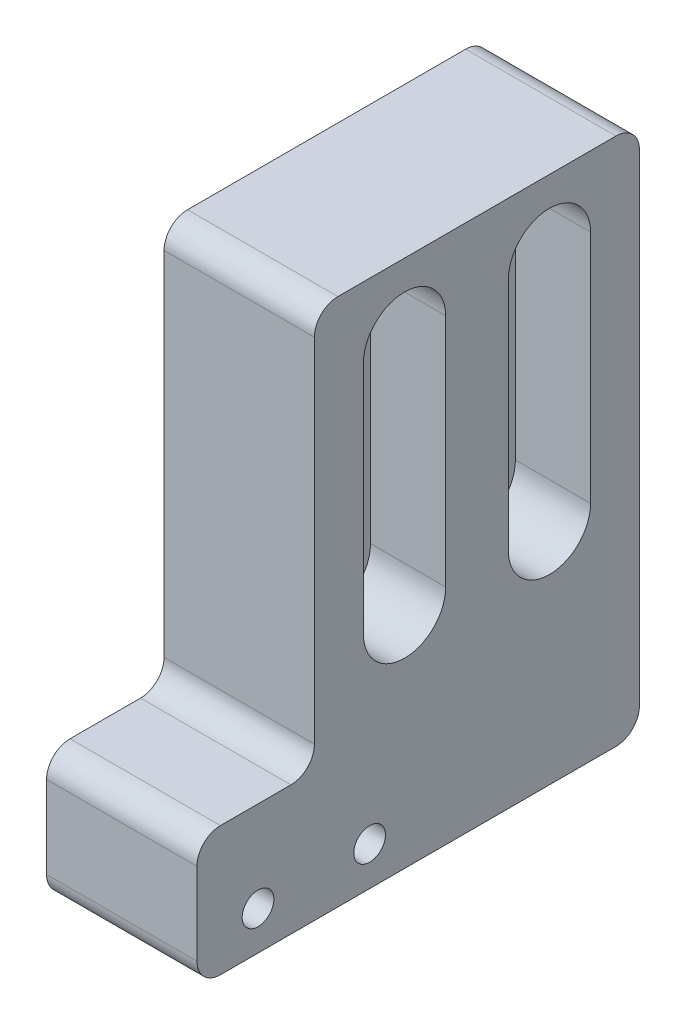
from build123d import *

# Parameters (mm, degrees)
SKETCH1_W                  = 37.6666666
SKETCH1_H                  = 45
BOSS_EXTRUDE1_DEPTH        = 12.8
SKETCH2_W                  = 10
SKETCH2_H                  = 34
CUT_EXTRUDE1_DEPTH         = 61.063447893
CUT_EXTRUDE2_DEPTH         = 6.4
CUT_EXTRUDE3_DEPTH         = 61.063447893
CUT_EXTRUDE4_DEPTH         = 6.4
CUT_EXTRUDE5_DEPTH         = 61.063447893
F_2_7_2_7_DIAMETER_HOLE1_D = 2.7
FILLET1_R                  = 2


with BuildPart() as part:
    # Sketch1 → Boss-Extrude1 (new body)
    with BuildSketch(Plane(origin=(0, 0, 0), x_dir=(0, 0, -1), z_dir=(1, 0, 0))):
        with Locations((-18.8333333, 22.5)):
            Rectangle(SKETCH1_W, SKETCH1_H)
    extrude(amount=-BOSS_EXTRUDE1_DEPTH)

    # Sketch2 → Cut-Extrude1 (cut, through all)
    with BuildSketch(Plane.ZY.offset(12.8)):
        with Locations((32.6666666, 28)):
            Rectangle(SKETCH2_W, SKETCH2_H)
    extrude(amount=-CUT_EXTRUDE1_DEPTH, mode=Mode.SUBTRACT)

    # Sketch3 → Cut-Extrude2 (cut)
    with BuildSketch(Plane(origin=(0, 0, 0), x_dir=(0, 0, -1), z_dir=(1, 0, 0))):
        with BuildLine():
            Line((-23.4933333, 39), (-23.4933333, 19))
            ThreePointArc((-23.4933333, 19), (-19.9933333, 15.5), (-16.4933333, 19))
            Line((-16.4933333, 19), (-16.4933333, 39))
            ThreePointArc((-16.4933333, 39), (-19.9933333, 42.5), (-23.4933333, 39))
        make_face()
    extrude(amount=-CUT_EXTRUDE2_DEPTH, mode=Mode.SUBTRACT)

    # Sketch4 → Cut-Extrude3 (cut, through all)
    with BuildSketch(Plane.ZY.offset(12.8)):
        with BuildLine():
            Line((21.4933333, 19), (21.4933333, 39))
            ThreePointArc((21.4933333, 39), (19.9933333, 40.5), (18.4933333, 39))
            Line((18.4933333, 39), (18.4933333, 19))
            ThreePointArc((18.4933333, 19), (19.9933333, 17.500288491), (21.4933333, 19))
        make_face()
    extrude(amount=-CUT_EXTRUDE3_DEPTH, mode=Mode.SUBTRACT)

    # Sketch5 → Cut-Extrude4 (cut)
    with BuildSketch(Plane(origin=(0, 0, 0), x_dir=(0, 0, -1), z_dir=(1, 0, 0))):
        with BuildLine():
            Line((-11.16, 39), (-11.16, 19))
            ThreePointArc((-11.16, 19), (-7.66, 15.5), (-4.16, 19))
            Line((-4.16, 19), (-4.16, 39))
            ThreePointArc((-4.16, 39), (-7.66, 42.5), (-11.16, 39))
        make_face()
    extrude(amount=-CUT_EXTRUDE4_DEPTH, mode=Mode.SUBTRACT)

    # Sketch6 → Cut-Extrude5 (cut, through all)
    with BuildSketch(Plane.ZY.offset(12.8)):
        with BuildLine():
            Line((6.16, 39), (6.16, 19))
            add(Edge.make_bspline(
                [(6.16, 19), (6.16, 18.832340191), (6.188940738, 18.662362459), (6.244463512, 18.504163113), (6.299983926, 18.345970491), (6.383577698, 18.195200889), (6.488243805, 18.06423361), (6.593105783, 17.93302124), (6.722000277, 17.818058166), (6.864319793, 17.728851239), (7.006949165, 17.639450093), (7.167029387, 17.573470631), (7.331255049, 17.536516135), (7.494915324, 17.499688864), (7.667199859, 17.490652088), (7.833819766, 17.510113335), (8.000323921, 17.529561063), (8.165758477, 17.578061145), (8.316432476, 17.651540351), (8.467050084, 17.724992056), (8.60707111, 17.825389016), (8.725036325, 17.944405925), (8.843438847, 18.063864039), (8.942888294, 18.205385466), (9.015071831, 18.357302993), (9.087259254, 18.5092287), (9.134141581, 18.67576982), (9.151759986, 18.843048139), (9.157247483, 18.895149292), (9.16, 18.947610662), (9.16, 19)],
                knots=[0, 0, 0, 0, 0.000502979, 0.000502979, 0.000502979, 0.001005909, 0.001005909, 0.001005909, 0.001509785, 0.001509785, 0.001509785, 0.002014828, 0.002014828, 0.002014828, 0.002518084, 0.002518084, 0.002518084, 0.003020994, 0.003020994, 0.003020994, 0.00352367, 0.00352367, 0.00352367, 0.004028264, 0.004028264, 0.004028264, 0.004532927, 0.004532927, 0.004532927, 0.004688075, 0.004688075, 0.004688075, 0.004688075], degree=3))
            Line((9.16, 19), (9.16, 39))
            add(Edge.make_bspline(
                [(9.16, 39), (9.16, 39.167659809), (9.131059262, 39.337637541), (9.075536488, 39.495836887), (9.020016074, 39.654029509), (8.936422302, 39.804799111), (8.831756195, 39.93576639), (8.726894217, 40.06697876), (8.597999723, 40.181941834), (8.455680207, 40.271148761), (8.313050835, 40.360549907), (8.152970613, 40.426529369), (7.988744951, 40.463483865), (7.825084676, 40.500311136), (7.652800141, 40.509347912), (7.486180234, 40.489886665), (7.319676079, 40.470438937), (7.154241523, 40.421938855), (7.003567524, 40.348459649), (6.852949916, 40.275007944), (6.71292889, 40.174610984), (6.594963675, 40.055594075), (6.476561153, 39.936135961), (6.377111706, 39.794614534), (6.304928169, 39.642697007), (6.232740746, 39.4907713), (6.185858419, 39.32423018), (6.168240014, 39.156951861), (6.162752517, 39.104850708), (6.16, 39.052389338), (6.16, 39)],
                knots=[0, 0, 0, 0, 0.000502979, 0.000502979, 0.000502979, 0.001005909, 0.001005909, 0.001005909, 0.001509785, 0.001509785, 0.001509785, 0.002014828, 0.002014828, 0.002014828, 0.002518084, 0.002518084, 0.002518084, 0.003020994, 0.003020994, 0.003020994, 0.00352367, 0.00352367, 0.00352367, 0.004028264, 0.004028264, 0.004028264, 0.004532927, 0.004532927, 0.004532927, 0.004688075, 0.004688075, 0.004688075, 0.004688075], degree=3))
        make_face()
    extrude(amount=-CUT_EXTRUDE5_DEPTH, mode=Mode.SUBTRACT)

    # Ø2.7 (2.7) Diameter Hole1 (through all)
    with Locations(Plane(origin=(0, 0, 0), x_dir=(0, 0, -1), z_dir=(1, 0, 0))):
        with Locations((-22.9666666, 3.3), (-32.4666666, 3.3)):
            Hole(F_2_7_2_7_DIAMETER_HOLE1_D / 2)

    # Fillet1
    fillet1_edges = [part.edges().sort_by_distance(p)[0] for p in [
        (-6.4, 0, 37.6666666),
        (-6.4, 45, 0),
        (-6.4, 0, 0),
        (-6.4, 11, 27.6666666),
        (-6.4, 45, 27.6666666),
        (-6.4, 11, 37.6666666),
    ]]
    fillet(fillet1_edges, radius=FILLET1_R)


solid = part.part
